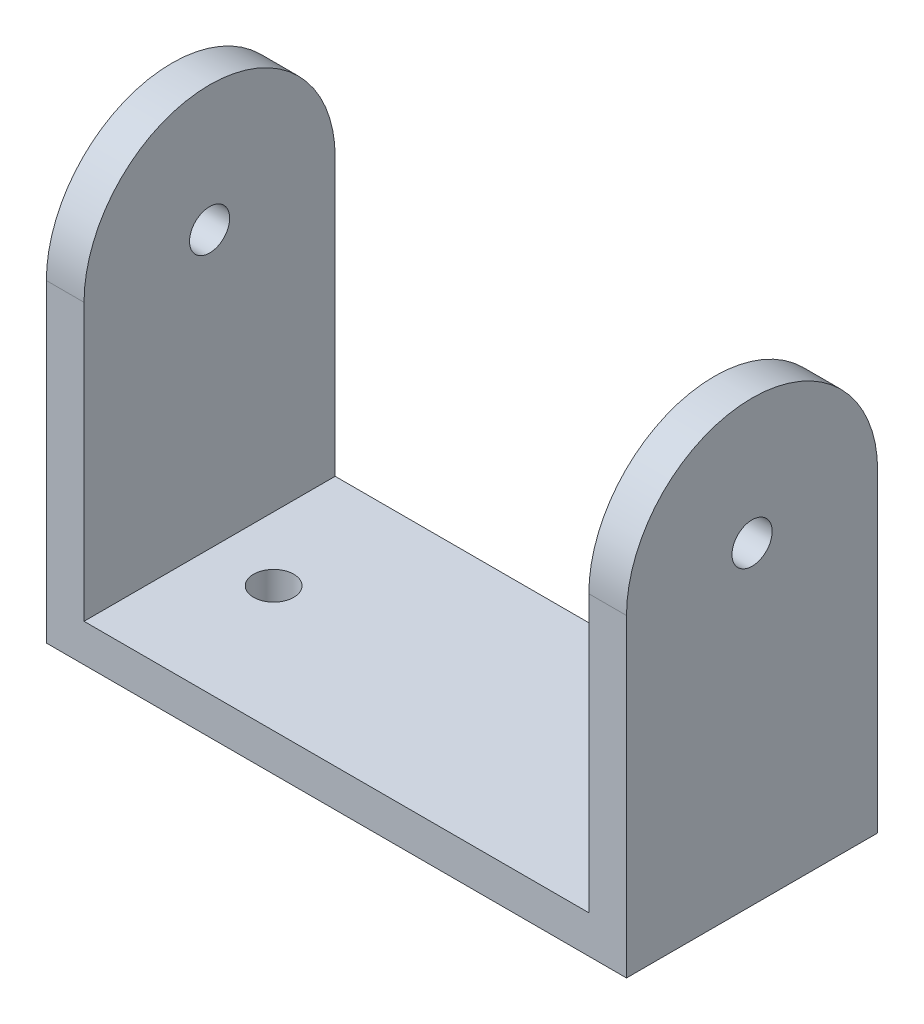
from build123d import *

# Parameters (mm, degrees)
ESQUISSE1_W             = 40.2
ESQUISSE1_H             = 20
BOSS_EXTRU_1_DEPTH      = 3
ESQUISSE2_W             = 3
ESQUISSE2_H             = 20
BOSS_EXTRU_2_DEPTH      = 35
ENL_V_MAT_EXTRU_1_DEPTH = 71
ESQUISSE4_R             = 1.6
ENL_V_MAT_EXTRU_2_DEPTH = 71
ESQUISSE5_R             = 1.6
ENL_V_MAT_EXTRU_3_DEPTH = 71


with BuildPart() as part:
    # Esquisse1 → Boss.-Extru.1 (new body)
    with BuildSketch(Plane(origin=(0, 0, 0), x_dir=(1, 0, 0), z_dir=(0, 1, 0))):
        Rectangle(ESQUISSE1_W, ESQUISSE1_H)
    extrude(amount=BOSS_EXTRU_1_DEPTH)

    # Esquisse2 → Boss.-Extru.2 (add)
    with BuildSketch(Plane.XZ):
        with Locations((-21.6, 0)):
            Rectangle(ESQUISSE2_W, ESQUISSE2_H)
        with Locations((21.6, 0)):
            Rectangle(ESQUISSE2_W, ESQUISSE2_H)
    extrude(amount=-BOSS_EXTRU_2_DEPTH)

    # Esquisse3 → Enlèv. mat.-Extru.1 (cut)
    with BuildSketch(Plane(origin=(23.1, 0, 0), x_dir=(0, 0, -1), z_dir=(1, 0, 0))):
        with BuildLine():
            Line((-10, 35), (-10, 25))
            ThreePointArc((-10, 25), (-7.071067812, 32.071067812), (0, 35))
            Line((0, 35), (-10, 35))
        make_face()
        with BuildLine():
            Line((10, 35), (0, 35))
            ThreePointArc((0, 35), (7.071067812, 32.071067812), (10, 25))
            Line((10, 25), (10, 35))
        make_face()
    extrude(amount=-ENL_V_MAT_EXTRU_1_DEPTH, mode=Mode.SUBTRACT)

    # Esquisse4 → Enlèv. mat.-Extru.2 (cut)
    with BuildSketch(Plane(origin=(23.1, 0, 0), x_dir=(0, 0, -1), z_dir=(1, 0, 0))):
        with Locations((0, 25)):
            Circle(ESQUISSE4_R)
    extrude(amount=-ENL_V_MAT_EXTRU_2_DEPTH, mode=Mode.SUBTRACT)

    # Esquisse5 → Enlèv. mat.-Extru.3 (cut)
    with BuildSketch(Plane(origin=(0, 3, 0), x_dir=(1, 0, 0), z_dir=(0, 1, 0))):
        with Locations(Location((-15, 0, 0), (0, 0, 270))):
            Circle(ESQUISSE5_R)
        with Locations(Location((15, 0, 0), (0, 0, 270))):
            Circle(ESQUISSE5_R)
    extrude(amount=-ENL_V_MAT_EXTRU_3_DEPTH, mode=Mode.SUBTRACT)


solid = part.part
